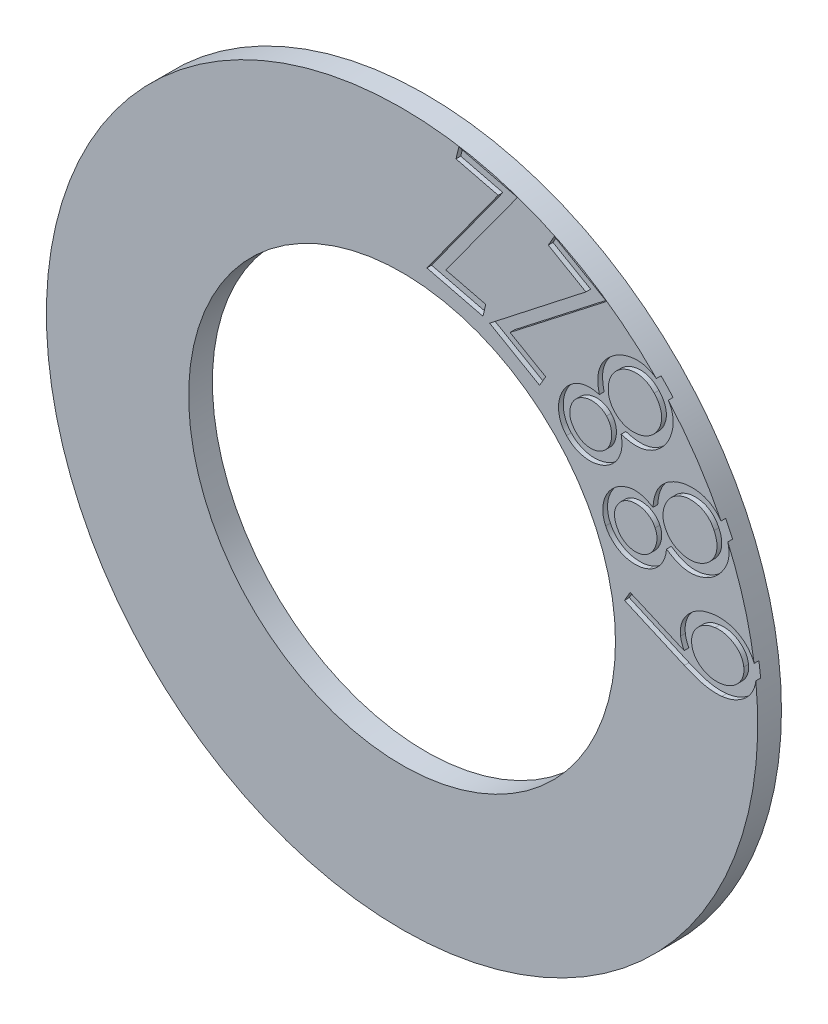
from build123d import *

# Parameters (mm, degrees)
IZIM1_R                     = 7.5
IZIM1_R_2                   = 4.5
Y_KSEKLIK_EKSTR_ZYON1_DEPTH = 0.5
KES_EKSTR_ZYON1_DEPTH       = 0.1


with BuildPart() as part:
    # Çizim1 → Yükseklik-Ekstrüzyon1 (new body)
    with BuildSketch(Plane.XY):
        Circle(IZIM1_R)
        Circle(IZIM1_R_2, mode=Mode.SUBTRACT)
    extrude(amount=Y_KSEKLIK_EKSTR_ZYON1_DEPTH)

    # Çizim3 → Kes-Ekstrüzyon1 (cut)
    # profile 1 of 5: a face of its own
    with BuildSketch(Plane.XY.offset(0.5)):
        with BuildLine():
            Line((4.690392127, 0.85544371), (4.808055389, 1.060559395))
            Line((4.808055389, 1.060559395), (5.947586972, 0.567115718))
            add(Edge.make_bspline(
                [(5.947586972, 0.567115718), (5.937844568, 0.586560073), (5.918878393, 0.624413671), (5.897416292, 0.682600342), (5.880799575, 0.73919763), (5.875100864, 0.77709254), (5.872324886, 0.79555205)],
                knots=[0, 0, 0, 0, 1.078670027, 2.099917552, 3.07442473, 4, 4, 4, 4], degree=3))
            add(Edge.make_bspline(
                [(5.872324886, 0.79555205), (5.870420722, 0.817973161), (5.866674494, 0.86208415), (5.869582633, 0.928055721), (5.879280581, 0.992417619), (5.897943786, 1.054542828), (5.922179843, 1.115310188), (5.955021763, 1.173759612), (5.995078282, 1.230508144), (6.041373668, 1.285309108), (6.093365596, 1.33624529), (6.149999146, 1.382152245), (6.210534258, 1.422718091), (6.27543474, 1.45688682), (6.343760298, 1.486390713), (6.416088088, 1.510223088), (6.492515856, 1.528431462), (6.545188911, 1.535547869), (6.571944278, 1.53916266)],
                knots=[0, 0, 0, 0, 0.950092344, 1.869198769, 2.783684095, 3.693371667, 4.604283996, 5.543399749, 6.518995273, 7.536159661, 8.570982113, 9.590117539, 10.613074668, 11.645173154, 12.685341756, 13.754892566, 14.859593905, 16, 16, 16, 16], degree=3))
            add(Edge.make_bspline(
                [(6.571944278, 1.53916266), (6.60884048, 1.542576625), (6.681185036, 1.549270587), (6.788468535, 1.543137586), (6.891666435, 1.526769324), (6.989806611, 1.496685276), (7.081914033, 1.456145731), (7.167107324, 1.404955811), (7.24301089, 1.341605913), (7.310796045, 1.269360378), (7.367780562, 1.189336408), (7.412527611, 1.1034987), (7.444008559, 1.012506882), (7.454104781, 0.949289425), (7.459188869, 0.917455429)],
                knots=[0, 0, 0, 0, 1.104296789, 2.165259742, 3.196627615, 4.215633266, 5.218750339, 6.193410861, 7.170819257, 8.159255232, 9.142263568, 10.092508404, 11.039457101, 12, 12, 12, 12], degree=3))
            add(Edge.make_bspline(
                [(7.459188869, 0.917455429), (7.461531418, 0.886369979), (7.466185289, 0.824613442), (7.456674422, 0.731933398), (7.433387994, 0.641642992), (7.397859563, 0.553942753), (7.349846485, 0.471044101), (7.289550057, 0.394630907), (7.217358317, 0.326171957), (7.134973186, 0.265704455), (7.044624668, 0.214360078), (6.948275318, 0.174207509), (6.847359797, 0.144192994), (6.777762628, 0.133961507), (6.742609008, 0.12879357)],
                knots=[0, 0, 0, 0, 0.945528766, 1.878453802, 2.814337968, 3.770077171, 4.743966831, 5.714568165, 6.716677142, 7.756794783, 8.811882674, 9.865427069, 10.921824477, 12, 12, 12, 12], degree=3))
            add(Edge.make_bspline(
                [(6.742609008, 0.12879357), (6.715601726, 0.126428951), (6.660599755, 0.12161326), (6.576156887, 0.122263202), (6.488917949, 0.130797253), (6.397321387, 0.144858389), (6.299303462, 0.169189069), (6.192337376, 0.202895152), (6.075089842, 0.246510222), (5.994601833, 0.28123352), (5.952357105, 0.2994583)],
                knots=[0, 0, 0, 0, 0.794709239, 1.618473624, 2.471672251, 3.363448282, 4.333518685, 5.429758057, 6.650989444, 8, 8, 8, 8], degree=3))
            Line((5.952357105, 0.2994583), (4.690392127, 0.85544371))
        make_face()
        with BuildLine():
            add(Edge.make_bspline(
                [(6.107651409, 0.767461271), (6.11016662, 0.751148713), (6.115112702, 0.719070596), (6.127854079, 0.672338882), (6.146138587, 0.628471886), (6.168291268, 0.586523618), (6.196337189, 0.547698607), (6.228861815, 0.511183367), (6.265539429, 0.476270144), (6.307198068, 0.445041193), (6.35181442, 0.417040595), (6.398791159, 0.393733198), (6.447092376, 0.374421459), (6.497171799, 0.360100773), (6.548990602, 0.350487568), (6.602401915, 0.345836902), (6.657377809, 0.345813473), (6.694217693, 0.349166677), (6.712928185, 0.350869725)],
                knots=[0, 0, 0, 0, 0.969428634, 1.906350004, 2.8375021, 3.757182853, 4.687640232, 5.643747754, 6.627851325, 7.657709016, 8.697616369, 9.719015019, 10.734965042, 11.750278372, 12.774469389, 13.827149458, 14.896437784, 16, 16, 16, 16], degree=3))
            add(Edge.make_bspline(
                [(6.712928185, 0.350869725), (6.731555125, 0.353291438), (6.768089219, 0.358041283), (6.820897286, 0.372000507), (6.871420403, 0.388620467), (6.919356339, 0.409934752), (6.964448423, 0.435549632), (7.007418549, 0.464880207), (7.047424207, 0.498737623), (7.084504421, 0.536336772), (7.117563856, 0.576593765), (7.145695923, 0.618789258), (7.169673983, 0.66171398), (7.186670454, 0.706527082), (7.200229428, 0.75211046), (7.20644641, 0.79923395), (7.209120615, 0.847538307), (7.206244323, 0.879833653), (7.204781818, 0.896254841)],
                knots=[0, 0, 0, 0, 1.103922224, 2.16518648, 3.207086629, 4.230734397, 5.245319171, 6.25435214, 7.287035669, 8.323321867, 9.357364397, 10.34612002, 11.30419056, 12.242206506, 13.160200449, 14.095044003, 15.031388573, 16, 16, 16, 16], degree=3))
            add(Edge.make_bspline(
                [(7.204781818, 0.896254841), (7.202333974, 0.912587754), (7.197513264, 0.944753308), (7.183847918, 0.991015827), (7.166305505, 1.035225929), (7.143646206, 1.076953587), (7.115552263, 1.115982975), (7.083207081, 1.152731639), (7.045641524, 1.186688534), (7.004250565, 1.218246575), (6.9593952, 1.246009673), (6.912740001, 1.270120452), (6.864404132, 1.289146444), (6.814586635, 1.303705622), (6.763079096, 1.313213247), (6.710033199, 1.317710279), (6.655410097, 1.31860333), (6.618745486, 1.315142506), (6.600035056, 1.313376402)],
                knots=[0, 0, 0, 0, 0.970766521, 1.911798814, 2.830692908, 3.76573424, 4.697475722, 5.654902746, 6.640912636, 7.672191611, 8.713534117, 9.741033578, 10.758385691, 11.765112564, 12.790717045, 13.834495564, 14.894914783, 16, 16, 16, 16], degree=3))
            add(Edge.make_bspline(
                [(6.600035056, 1.313376402), (6.581442491, 1.310625398), (6.544703956, 1.30518947), (6.491114735, 1.29278117), (6.440588514, 1.274910165), (6.392467651, 1.253651484), (6.346802708, 1.228432428), (6.304351424, 1.198144801), (6.263530337, 1.165086332), (6.227257235, 1.126835109), (6.193656929, 1.087096027), (6.165574431, 1.045058654), (6.142417415, 1.001834004), (6.124852188, 0.957164102), (6.112767469, 0.911237488), (6.104973363, 0.864400808), (6.103575613, 0.816149919), (6.106277362, 0.783875367), (6.107651409, 0.767461271)],
                knots=[0, 0, 0, 0, 1.103903304, 2.181290692, 3.22501169, 4.247147992, 5.269284295, 6.282743023, 7.307247517, 8.34941943, 9.373923924, 10.361219601, 11.312965346, 12.249596265, 13.17349119, 14.09826005, 15.032818775, 16, 16, 16, 16], degree=3))
        make_face(mode=Mode.SUBTRACT)
    # profile 2 of 5: a face of its own
    with BuildSketch(Plane.XY.offset(0.5)):
        with BuildLine():
            add(Edge.make_bspline(
                [(5.288978511, 2.852474636), (5.290829472, 2.874412339), (5.294439235, 2.917195472), (5.304236205, 2.979431084), (5.31647178, 3.038494899), (5.330813772, 3.094462848), (5.349273339, 3.146876064), (5.369818966, 3.196147765), (5.392886737, 3.242515047), (5.428721001, 3.299042387), (5.479502713, 3.364610343), (5.552363717, 3.433525687), (5.635151889, 3.494165528), (5.696949487, 3.525544211), (5.728360689, 3.541493733)],
                knots=[0, 0, 0, 0, 0.918572573, 1.791409631, 2.627241988, 3.435629972, 4.200475535, 4.944056206, 5.662915143, 6.358520021, 7.734681159, 9.111474252, 10.531786505, 12, 12, 12, 12], degree=3))
            add(Edge.make_bspline(
                [(5.728360689, 3.541493733), (5.751180301, 3.551577602), (5.796340352, 3.571533596), (5.866077062, 3.594798494), (5.93613486, 3.612077282), (6.006167942, 3.624945758), (6.076676456, 3.629709652), (6.147349206, 3.629901086), (6.218500823, 3.624276284), (6.265499894, 3.615743347), (6.289116231, 3.611455672)],
                knots=[0, 0, 0, 0, 1.040759969, 2.059665662, 3.062870955, 4.050786753, 5.026827698, 6.007452911, 6.998774567, 8, 8, 8, 8], degree=3))
            add(Edge.make_bspline(
                [(6.289116231, 3.611455672), (6.317417311, 3.60455137), (6.373317585, 3.590913996), (6.452713566, 3.558609017), (6.526326349, 3.517553935), (6.594504858, 3.467726196), (6.656758236, 3.408509992), (6.712825322, 3.33994318), (6.764601125, 3.263298029), (6.792568742, 3.206890196), (6.806940583, 3.177903656)],
                knots=[0, 0, 0, 0, 0.995043861, 1.965409918, 2.920078623, 3.871012791, 4.845301127, 5.849290613, 6.894805549, 8, 8, 8, 8], degree=3))
            add(Edge.make_bspline(
                [(6.806940583, 3.177903656), (6.819486805, 3.149495991), (6.843867274, 3.094292745), (6.870709082, 3.009999012), (6.887077072, 2.92747333), (6.894958331, 2.84698804), (6.892786941, 2.768316705), (6.881338666, 2.69144147), (6.859007187, 2.616697531), (6.82838628, 2.544539541), (6.790444235, 2.476431452), (6.749502158, 2.41168655), (6.702946504, 2.352916352), (6.653055635, 2.298629588), (6.59925641, 2.248808372), (6.540914961, 2.204508275), (6.478587653, 2.164743555), (6.434378353, 2.142748657), (6.412079639, 2.131654657)],
                knots=[0, 0, 0, 0, 1.188436708, 2.309431789, 3.378659435, 4.404446939, 5.399164694, 6.384523725, 7.37129802, 8.377631574, 9.379590735, 10.353389191, 11.307369044, 12.245631515, 13.174335885, 14.110547934, 15.046979885, 16, 16, 16, 16], degree=3))
            add(Edge.make_bspline(
                [(6.412079639, 2.131654657), (6.379004992, 2.11752975), (6.314171382, 2.089841815), (6.212659969, 2.063742198), (6.110652496, 2.051823469), (6.025200852, 2.054205815), (5.956729677, 2.063042069), (5.904551147, 2.075089235), (5.85160116, 2.090975822), (5.797836208, 2.111107147), (5.743720474, 2.13640174), (5.688659778, 2.16550146), (5.63265741, 2.198990336), (5.596073002, 2.224197303), (5.577306502, 2.237127581)],
                knots=[0, 0, 0, 0, 1.456822636, 2.855693965, 4.233173914, 5.609237086, 6.310413577, 7.030015753, 7.778018477, 8.551161208, 9.355796595, 10.198691958, 11.075993079, 12, 12, 12, 12], degree=3))
            add(Edge.make_bspline(
                [(5.577306502, 2.237127581), (5.573339009, 2.205531827), (5.565596716, 2.143874856), (5.540727116, 2.055695663), (5.506264115, 1.974286456), (5.461538544, 1.900427451), (5.408336261, 1.834695414), (5.348286144, 1.776736079), (5.28145728, 1.726616588), (5.231798656, 1.701295761), (5.206826234, 1.688562376)],
                knots=[0, 0, 0, 0, 1.100325923, 2.147211426, 3.157565508, 4.150165871, 5.123749613, 6.07466349, 7.031783152, 8, 8, 8, 8], degree=3))
            add(Edge.make_bspline(
                [(5.206826234, 1.688562376), (5.180390368, 1.677625709), (5.127357472, 1.655685699), (5.042790759, 1.635109919), (4.954434521, 1.62592667), (4.863745888, 1.626355017), (4.772704852, 1.637483404), (4.685057158, 1.661855894), (4.601073654, 1.696290772), (4.523197808, 1.743179003), (4.451577403, 1.799079847), (4.38863357, 1.863871409), (4.334029342, 1.936222494), (4.306455208, 1.99003594), (4.292550893, 2.017171484)],
                knots=[0, 0, 0, 0, 0.955507189, 1.916839586, 2.897291974, 3.91923562, 4.943532525, 5.953800357, 6.95209857, 7.969216454, 8.98312161, 9.981489727, 10.982161936, 12, 12, 12, 12], degree=3))
            add(Edge.make_bspline(
                [(4.292550893, 2.017171484), (4.280933942, 2.044443124), (4.257844195, 2.09864799), (4.238251729, 2.184614901), (4.229972929, 2.272321211), (4.234544546, 2.360921185), (4.250132554, 2.448885738), (4.27813439, 2.533561946), (4.316590271, 2.614633978), (4.366261226, 2.690359431), (4.425037913, 2.759198332), (4.489799945, 2.820974678), (4.561890128, 2.873082001), (4.614418071, 2.89994804), (4.640770545, 2.913426325)],
                knots=[0, 0, 0, 0, 0.998529056, 1.984667335, 2.960462962, 3.963094156, 4.968698214, 5.965945232, 6.96319225, 7.988325783, 9.011898171, 10.01135212, 11.002325453, 12, 12, 12, 12], degree=3))
            add(Edge.make_bspline(
                [(4.640770545, 2.913426325), (4.667529185, 2.924971812), (4.719938587, 2.947584773), (4.801831327, 2.967885956), (4.883407318, 2.978057115), (4.965132051, 2.975576855), (5.04703605, 2.9623492), (5.128579081, 2.936736688), (5.210360573, 2.900663399), (5.262291456, 2.868832431), (5.288978511, 2.852474636)],
                knots=[0, 0, 0, 0, 1.022866661, 2.003383972, 2.953905011, 3.904365191, 4.867101064, 5.861056097, 6.900806064, 8, 8, 8, 8], degree=3))
        make_face()
        with BuildLine():
            add(Edge.make_bspline(
                [(4.52946746, 2.116814246), (4.536523364, 2.10293444), (4.550377867, 2.075680978), (4.573981736, 2.037231392), (4.601446139, 2.00292819), (4.631800976, 1.972447824), (4.663976496, 1.944232701), (4.70005276, 1.921174388), (4.738196158, 1.900763144), (4.778990257, 1.884574117), (4.820840507, 1.871961948), (4.862887053, 1.863375966), (4.904609481, 1.859040115), (4.946162698, 1.85907248), (4.987568565, 1.863242389), (5.028455148, 1.872022079), (5.069350632, 1.883924332), (5.095468079, 1.895653103), (5.108773516, 1.901628282)],
                knots=[0, 0, 0, 0, 1.084238311, 2.128938158, 3.135856305, 4.136439674, 5.122697777, 6.108955881, 7.110673398, 8.131997615, 9.159676076, 10.151444899, 11.116208585, 12.075937592, 13.040701278, 14.008363688, 14.985368188, 16, 16, 16, 16], degree=3))
            add(Edge.make_bspline(
                [(5.108773516, 1.901628282), (5.121637728, 1.908084871), (5.147386516, 1.92100827), (5.183239801, 1.9449079), (5.216319402, 1.972196482), (5.246863971, 2.002570595), (5.274287935, 2.036686779), (5.299403016, 2.073772669), (5.321070837, 2.114659778), (5.340380573, 2.157797793), (5.356399677, 2.202536975), (5.367462228, 2.247477542), (5.374058111, 2.291855906), (5.375501958, 2.335383624), (5.372988024, 2.378389238), (5.36555558, 2.420713194), (5.353266982, 2.462431201), (5.341894426, 2.489162291), (5.336149818, 2.50266494)],
                knots=[0, 0, 0, 0, 0.974154621, 1.949851266, 2.910463483, 3.875017377, 4.861730948, 5.870614176, 6.903895825, 7.991257657, 9.069827641, 10.117489305, 11.120965221, 12.102805744, 13.061926326, 14.033726492, 15.006778171, 16, 16, 16, 16], degree=3))
            add(Edge.make_bspline(
                [(5.336149818, 2.50266494), (5.327437026, 2.51938315), (5.309974301, 2.552890837), (5.275054205, 2.598151924), (5.233155586, 2.638134424), (5.185489536, 2.672878471), (5.133541952, 2.70208676), (5.077612529, 2.723403891), (5.01882712, 2.737458548), (4.957836773, 2.742740909), (4.89705629, 2.741831898), (4.838257583, 2.734297804), (4.7820447, 2.721092273), (4.747127769, 2.706170064), (4.729813013, 2.698770376)],
                knots=[0, 0, 0, 0, 0.962022447, 1.928145911, 2.905135172, 3.912807161, 4.935335856, 5.941388574, 6.961922245, 8.013961138, 9.061457243, 10.062636432, 11.039291879, 12, 12, 12, 12], degree=3))
            add(Edge.make_bspline(
                [(4.729813013, 2.698770376), (4.706635609, 2.686374378), (4.660530677, 2.661716022), (4.600880685, 2.609051204), (4.549967293, 2.545638135), (4.516147169, 2.484511703), (4.494597167, 2.431476038), (4.484096671, 2.389543819), (4.478847833, 2.346475988), (4.478201926, 2.302544946), (4.48321078, 2.257391852), (4.493393124, 2.211230444), (4.508888847, 2.163918011), (4.522489762, 2.132785966), (4.52946746, 2.116814246)],
                knots=[0, 0, 0, 0, 1.370013706, 2.725257293, 4.124221619, 5.60420244, 6.358743575, 7.111304209, 7.855832895, 8.622372093, 9.402530163, 10.224888975, 11.089312109, 12, 12, 12, 12], degree=3))
        make_face(mode=Mode.SUBTRACT)
        with BuildLine():
            add(Edge.make_bspline(
                [(5.550275753, 2.60654782), (5.559101757, 2.589027828), (5.576422712, 2.554644999), (5.608227285, 2.507287298), (5.643080611, 2.463887959), (5.682792701, 2.425536015), (5.726252383, 2.391483764), (5.773884647, 2.362340749), (5.825014709, 2.337068758), (5.87990735, 2.317448345), (5.936228886, 2.302020006), (5.993080122, 2.292683903), (6.049272229, 2.287424593), (6.104991183, 2.288919416), (6.160264109, 2.294404201), (6.214850765, 2.306410955), (6.269247529, 2.323182545), (6.304266606, 2.338542479), (6.321977142, 2.346310607)],
                knots=[0, 0, 0, 0, 1.039478497, 2.039967418, 3.01894652, 3.98633379, 4.960953963, 5.941232486, 6.942729988, 7.980179572, 9.027943913, 10.035340982, 11.032093689, 12.016081762, 12.986640059, 13.973478986, 14.975107967, 16, 16, 16, 16], degree=3))
            add(Edge.make_bspline(
                [(6.321977142, 2.346310607), (6.343329079, 2.357241736), (6.385659222, 2.378912663), (6.443256595, 2.421120528), (6.495531741, 2.469678368), (6.542115859, 2.524349084), (6.580614177, 2.584695082), (6.610810529, 2.648481619), (6.630583368, 2.71573714), (6.640479743, 2.785496359), (6.641358446, 2.857268053), (6.630488587, 2.930019276), (6.611253053, 3.003778839), (6.590644408, 3.051289071), (6.580094296, 3.075610821)],
                knots=[0, 0, 0, 0, 0.9955781, 1.973730258, 2.955650423, 3.955928368, 4.94985356, 5.922146149, 6.87929507, 7.851199463, 8.842436201, 9.850685683, 10.89970896, 12, 12, 12, 12], degree=3))
            add(Edge.make_bspline(
                [(6.580094296, 3.075610821), (6.570855984, 3.093971062), (6.552759087, 3.129936875), (6.521085229, 3.179986503), (6.485113923, 3.224394626), (6.445912359, 3.263726909), (6.403283994, 3.297941397), (6.357136797, 3.326725172), (6.307774401, 3.350983019), (6.254944614, 3.368294984), (6.201071977, 3.381577148), (6.147003086, 3.390272135), (6.093223778, 3.393276074), (6.039968541, 3.391940256), (5.987124501, 3.38476733), (5.934652152, 3.373077834), (5.882173384, 3.35675773), (5.848365875, 3.341839854), (5.831183539, 3.334257989)],
                knots=[0, 0, 0, 0, 1.112996978, 2.180245852, 3.201087343, 4.20263603, 5.183112689, 6.154957232, 7.143712813, 8.154546254, 9.159609558, 10.147716501, 11.116020443, 12.073480561, 13.029073491, 13.999644906, 14.983339079, 16, 16, 16, 16], degree=3))
            add(Edge.make_bspline(
                [(5.831183539, 3.334257989), (5.814923759, 3.326100767), (5.782796022, 3.309982891), (5.738109361, 3.280327349), (5.696572836, 3.247574053), (5.658610853, 3.210593367), (5.624181656, 3.16976519), (5.593298289, 3.125033017), (5.566332456, 3.076427826), (5.542671037, 3.025148755), (5.523514644, 2.972019653), (5.510393385, 2.918327521), (5.502136472, 2.865126304), (5.500016426, 2.812325625), (5.503707971, 2.760049472), (5.51345704, 2.708187364), (5.528756917, 2.656659176), (5.543047532, 2.623380327), (5.550275753, 2.60654782)],
                knots=[0, 0, 0, 0, 1.009792623, 1.995251644, 2.973203886, 3.944930531, 4.933951141, 5.935842479, 6.959703768, 8.018123548, 9.070519159, 10.091742597, 11.084214957, 12.056684835, 13.020997599, 13.989298027, 14.982982938, 16, 16, 16, 16], degree=3))
        make_face(mode=Mode.SUBTRACT)
    # profile 3 of 5: a face of its own
    with BuildSketch(Plane.XY.offset(0.5)):
        with BuildLine():
            add(Edge.make_bspline(
                [(4.16010177, 4.348573469), (4.155208124, 4.369716417), (4.145596509, 4.411243301), (4.136592249, 4.47314513), (4.129833393, 4.532694785), (4.127190422, 4.590057851), (4.128125473, 4.645133462), (4.132938704, 4.698092693), (4.141228134, 4.748820657), (4.157719628, 4.813398647), (4.186526447, 4.890745468), (4.234635862, 4.977991397), (4.294613255, 5.060598523), (4.343478982, 5.109247306), (4.368397543, 5.134055239)],
                knots=[0, 0, 0, 0, 0.910773561, 1.788851188, 2.624384819, 3.426350955, 4.197930989, 4.935308309, 5.657226849, 6.353460972, 7.731251492, 9.108822353, 10.525674478, 12, 12, 12, 12], degree=3))
            add(Edge.make_bspline(
                [(4.368397543, 5.134055239), (4.387047164, 5.15062024), (4.42393541, 5.183385188), (4.48306874, 5.226560625), (4.543587471, 5.265392033), (4.606857051, 5.297401323), (4.671937354, 5.324840536), (4.739138232, 5.346461133), (4.808474278, 5.362638563), (4.855591795, 5.368884735), (4.879331705, 5.372031835)],
                knots=[0, 0, 0, 0, 1.043102063, 2.063216622, 3.059895826, 4.048372676, 5.025815305, 6.012300148, 6.998508006, 8, 8, 8, 8], degree=3))
            add(Edge.make_bspline(
                [(4.879331705, 5.372031835), (4.908294068, 5.374174885), (4.965193517, 5.378385118), (5.049970284, 5.372084863), (5.132042838, 5.356247333), (5.21173448, 5.330081402), (5.288662518, 5.293135659), (5.36229577, 5.245282848), (5.434257095, 5.188502335), (5.477679667, 5.143774445), (5.499978907, 5.120804872)],
                knots=[0, 0, 0, 0, 1.000003386, 1.964606322, 2.920149394, 3.875420702, 4.847912772, 5.85313254, 6.897497083, 8, 8, 8, 8], degree=3))
            add(Edge.make_bspline(
                [(5.499978907, 5.120804872), (5.52036992, 5.097658153), (5.559952796, 5.052725921), (5.610829214, 4.981148262), (5.651694957, 4.908423788), (5.683830115, 4.834736876), (5.704770601, 4.759395843), (5.717491809, 4.683157772), (5.719418181, 4.605620863), (5.711604772, 4.528053799), (5.696637455, 4.451966582), (5.676622685, 4.378543976), (5.651031342, 4.308708376), (5.620179046, 4.242238335), (5.584122435, 4.178727277), (5.542012002, 4.119120697), (5.495497281, 4.062114627), (5.460065838, 4.02809902), (5.442207306, 4.010954111)],
                knots=[0, 0, 0, 0, 1.187738255, 2.305628264, 3.375177906, 4.396593427, 5.39405759, 6.379774244, 7.366969913, 8.371928347, 9.376978953, 10.351115498, 11.300620501, 12.238443978, 13.171216305, 14.109558211, 15.047159418, 16, 16, 16, 16], degree=3))
            add(Edge.make_bspline(
                [(5.442207306, 4.010954111), (5.415263447, 3.987352849), (5.362246232, 3.940912835), (5.273127537, 3.886087443), (5.18037483, 3.84273442), (5.098699296, 3.818653673), (5.031185286, 3.806769901), (4.978222298, 3.801269832), (4.923295949, 3.800548954), (4.866261285, 3.803026605), (4.807367229, 3.810258351), (4.746271581, 3.820749972), (4.683167012, 3.835739758), (4.640770258, 3.848219423), (4.619094492, 3.854599777)],
                knots=[0, 0, 0, 0, 1.456859068, 2.866649892, 4.244933032, 5.618114645, 6.31976948, 7.03589144, 7.784510865, 8.555423005, 9.359742658, 10.199813125, 11.079636349, 12, 12, 12, 12], degree=3))
            add(Edge.make_bspline(
                [(4.619094492, 3.854599777), (4.624851705, 3.823429809), (4.63607393, 3.762671872), (4.638994768, 3.671559916), (4.630841674, 3.583975138), (4.610327141, 3.500517243), (4.58027651, 3.421907348), (4.540360674, 3.349122901), (4.492273262, 3.281276991), (4.452923661, 3.242079693), (4.433059336, 3.222292252)],
                knots=[0, 0, 0, 0, 1.100305112, 2.144765416, 3.156516326, 4.14834052, 5.122135624, 6.072794759, 7.027115121, 8, 8, 8, 8], degree=3))
            add(Edge.make_bspline(
                [(4.433059336, 3.222292252), (4.411489969, 3.203575836), (4.368321837, 3.166117496), (4.293595638, 3.12206147), (4.213440745, 3.084874868), (4.126930601, 3.058344344), (4.037481468, 3.0419001), (3.947090259, 3.036618184), (3.857289816, 3.04513407), (3.768988228, 3.064414612), (3.6843841, 3.09572584), (3.605108886, 3.137544564), (3.531497754, 3.189328586), (3.489214255, 3.232037188), (3.467902585, 3.253563119)],
                knots=[0, 0, 0, 0, 0.958493076, 1.918292515, 2.904607435, 3.92495742, 4.951583782, 5.957037092, 6.959097126, 7.975305001, 8.988434373, 9.982342338, 10.983063001, 12, 12, 12, 12], degree=3))
            add(Edge.make_bspline(
                [(3.467902585, 3.253563119), (3.448629714, 3.275815263), (3.410439041, 3.319909597), (3.365988662, 3.395444345), (3.331666384, 3.475910948), (3.309054435, 3.56125302), (3.297973862, 3.649133222), (3.298460909, 3.737712358), (3.310827136, 3.825922066), (3.334802364, 3.912551562), (3.368967403, 3.995875553), (3.412879889, 4.073575965), (3.464579514, 4.145722278), (3.506330907, 4.187282235), (3.52726423, 4.208119576)],
                knots=[0, 0, 0, 0, 0.997253143, 1.976133733, 2.959429452, 3.958555237, 4.961756282, 5.95704297, 6.955880885, 7.975502139, 8.999836723, 10.00380787, 10.999148732, 12, 12, 12, 12], degree=3))
            add(Edge.make_bspline(
                [(3.52726423, 4.208119576), (3.549248857, 4.22708114), (3.592301505, 4.264213702), (3.663473633, 4.309003167), (3.738000498, 4.342914902), (3.815992355, 4.365811686), (3.897471028, 4.378028762), (3.98243903, 4.379489887), (4.070853961, 4.369751319), (4.129838662, 4.355754682), (4.16010177, 4.348573469)],
                knots=[0, 0, 0, 0, 1.024386936, 2.00606405, 2.958442767, 3.908262284, 4.867628377, 5.860057161, 6.902065806, 8, 8, 8, 8], degree=3))
        make_face()
        with BuildLine():
            add(Edge.make_bspline(
                [(3.662417976, 3.419457717), (3.673198597, 3.408502005), (3.69445337, 3.386902028), (3.728792003, 3.358106597), (3.765327132, 3.334268449), (3.802702935, 3.313849134), (3.842147961, 3.298444839), (3.882757519, 3.28674983), (3.925207783, 3.279251472), (3.96872118, 3.276171358), (4.012174164, 3.277317266), (4.054641523, 3.281915729), (4.095430401, 3.291062522), (4.134844166, 3.303790837), (4.172898186, 3.320369012), (4.209298419, 3.34097935), (4.244139597, 3.365665151), (4.265729969, 3.384462007), (4.276705002, 3.394017012)],
                knots=[0, 0, 0, 0, 1.075861386, 2.12113833, 3.129764009, 4.125872965, 5.097488469, 6.088052319, 7.080467979, 8.109814838, 9.136780668, 10.120291393, 11.095678955, 12.057958633, 13.016255018, 13.996649415, 14.981636942, 16, 16, 16, 16], degree=3))
            add(Edge.make_bspline(
                [(4.276705002, 3.394017012), (4.287017008, 3.40404101), (4.307528128, 3.423979267), (4.334004166, 3.457872548), (4.357172734, 3.493729113), (4.377305443, 3.531640116), (4.392440524, 3.572411014), (4.40453643, 3.615323599), (4.413827878, 3.660441981), (4.418272003, 3.70733369), (4.419289842, 3.754262436), (4.417150336, 3.800138077), (4.409195063, 3.843843852), (4.398693287, 3.885896239), (4.382109263, 3.925361147), (4.362612116, 3.963459353), (4.338346381, 3.999373452), (4.319168387, 4.021217382), (4.309565913, 4.032154699)],
                knots=[0, 0, 0, 0, 0.978343677, 1.945976868, 2.920392182, 3.883602655, 4.862242172, 5.875255825, 6.918120067, 7.994316268, 9.077349785, 10.113740222, 11.114535456, 12.097969904, 13.058622444, 14.021832916, 15.009526265, 16, 16, 16, 16], degree=3))
            add(Edge.make_bspline(
                [(4.309565913, 4.032154699), (4.296340046, 4.045312951), (4.269855029, 4.071662566), (4.223112682, 4.103418466), (4.171621362, 4.128430609), (4.116218504, 4.146965196), (4.058098682, 4.15776968), (3.998737203, 4.162141617), (3.938894535, 4.156088152), (3.879470603, 4.143625626), (3.822299108, 4.124083495), (3.76869008, 4.099053985), (3.71970879, 4.068598846), (3.690927118, 4.04383924), (3.676728373, 4.031624684)],
                knots=[0, 0, 0, 0, 0.958279546, 1.918970511, 2.890608901, 3.896716908, 4.914704877, 5.925728751, 6.947888569, 7.998001122, 9.044369245, 10.04879215, 11.037418585, 12, 12, 12, 12], degree=3))
            add(Edge.make_bspline(
                [(3.676728373, 4.031624684), (3.658404358, 4.012859348), (3.621860791, 3.975435655), (3.581655473, 3.906809076), (3.552868753, 3.831043013), (3.538708426, 3.763000131), (3.534742671, 3.706369689), (3.537766458, 3.663538248), (3.544718131, 3.620995802), (3.558612343, 3.579441282), (3.576522741, 3.538225865), (3.60045941, 3.497985924), (3.628135335, 3.4572215), (3.650785074, 3.432271852), (3.662417976, 3.419457717)],
                knots=[0, 0, 0, 0, 1.374212681, 2.740591082, 4.142632452, 5.621388738, 6.374974774, 7.119292814, 7.873450745, 8.634041207, 9.415654445, 10.231119753, 11.091503363, 12, 12, 12, 12], degree=3))
        make_face(mode=Mode.SUBTRACT)
        with BuildLine():
            add(Edge.make_bspline(
                [(4.481820687, 4.195929238), (4.495490544, 4.182012823), (4.522300493, 4.154719313), (4.566830065, 4.119707874), (4.613196928, 4.089653223), (4.662156902, 4.065017037), (4.713866575, 4.046598061), (4.767667989, 4.033309861), (4.823764674, 4.025190916), (4.881657595, 4.023381167), (4.939646812, 4.026465173), (4.996366621, 4.034548069), (5.051028744, 4.046879556), (5.103247291, 4.065522667), (5.15394468, 4.087492431), (5.202317188, 4.115161406), (5.248037739, 4.148405555), (5.276667556, 4.173275662), (5.291153119, 4.185858959)],
                knots=[0, 0, 0, 0, 1.040134967, 2.039960301, 3.015483818, 3.98529512, 4.957578216, 5.938599475, 6.938647067, 7.976471856, 9.024567535, 10.033949785, 11.031104166, 12.009130487, 12.988473894, 13.976672958, 14.976275985, 16, 16, 16, 16], degree=3))
            add(Edge.make_bspline(
                [(5.291153119, 4.185858959), (5.308007133, 4.202791254), (5.341527598, 4.236467411), (5.384122309, 4.293576279), (5.418681788, 4.355804229), (5.446145358, 4.42167968), (5.46565432, 4.490102516), (5.473852617, 4.559619694), (5.473227005, 4.629097656), (5.460999922, 4.698051576), (5.440098129, 4.766238318), (5.408009079, 4.831877011), (5.367103233, 4.895614712), (5.333364009, 4.934461232), (5.316063809, 4.95438026)],
                knots=[0, 0, 0, 0, 0.997552201, 1.984003046, 2.965800533, 3.96542733, 4.961420748, 5.928532193, 6.881131814, 7.854648413, 8.844822715, 9.852082954, 10.898629317, 12, 12, 12, 12], degree=3))
            add(Edge.make_bspline(
                [(5.316063809, 4.95438026), (5.301853236, 4.968981334), (5.27397127, 4.997629487), (5.228298774, 5.034800855), (5.180724378, 5.06545103), (5.132217485, 5.091729834), (5.08131047, 5.110629262), (5.028771571, 5.123234894), (4.974823994, 5.131060743), (4.919692131, 5.131734872), (4.86478474, 5.127316324), (4.811124435, 5.119168046), (4.759458253, 5.105544054), (4.709165187, 5.088313535), (4.661131407, 5.065221495), (4.614662867, 5.038207336), (4.570496472, 5.006159699), (4.542941049, 4.981987228), (4.528991995, 4.969750686)],
                knots=[0, 0, 0, 0, 1.110318426, 2.178508887, 3.201843231, 4.192931188, 5.180595688, 6.152538376, 7.134785554, 8.146446154, 9.151249831, 10.136327155, 11.101274946, 12.06096728, 13.030520137, 14.001985329, 14.988568745, 16, 16, 16, 16], degree=3))
            add(Edge.make_bspline(
                [(4.528991995, 4.969750686), (4.515982164, 4.957121565), (4.490250312, 4.932142711), (4.457041647, 4.890327368), (4.427575983, 4.846676739), (4.40231249, 4.800332317), (4.382529673, 4.750903162), (4.366361987, 4.699402154), (4.355324241, 4.645216402), (4.348626591, 4.589395234), (4.346077209, 4.533148036), (4.350142975, 4.478335807), (4.358254134, 4.425681609), (4.372378923, 4.375281133), (4.391300777, 4.326729674), (4.41649789, 4.280773256), (4.446376509, 4.23661677), (4.46986488, 4.2096537), (4.481820687, 4.195929238)],
                knots=[0, 0, 0, 0, 1.012374603, 2.002353075, 2.977248304, 3.953592448, 4.945538484, 5.948042634, 6.966609482, 8.030859327, 9.088078277, 10.107410533, 11.097585937, 12.060558316, 13.026815316, 14.00315946, 14.983588953, 16, 16, 16, 16], degree=3))
        make_face(mode=Mode.SUBTRACT)
    # profile 4 of 5: a face of its own
    with BuildSketch(Plane.XY.offset(0.5)):
        Polygon((3.027810278, 4.108503585), (2.900076738, 3.887487459), (1.846407534, 4.495944324), (3.875833782, 6.081218262), (3.082401791, 6.539150954), (3.211195361, 6.761757124), (4.312565887, 6.125739496), (2.276779462, 4.542055602), align=None)
    # profile 5 of 5: a face of its own
    with BuildSketch(Plane.XY.offset(0.5)):
        Polygon((1.765378086, 4.798487722), (1.704956411, 4.551500877), (0.522493638, 4.842478942), (2.026675328, 6.921726571), (1.136780663, 7.140622638), (1.197732353, 7.389199528), (2.43372661, 7.085501111), (0.922654729, 5.005723466), align=None)
    extrude(amount=-KES_EKSTR_ZYON1_DEPTH, mode=Mode.SUBTRACT)


solid = part.part
